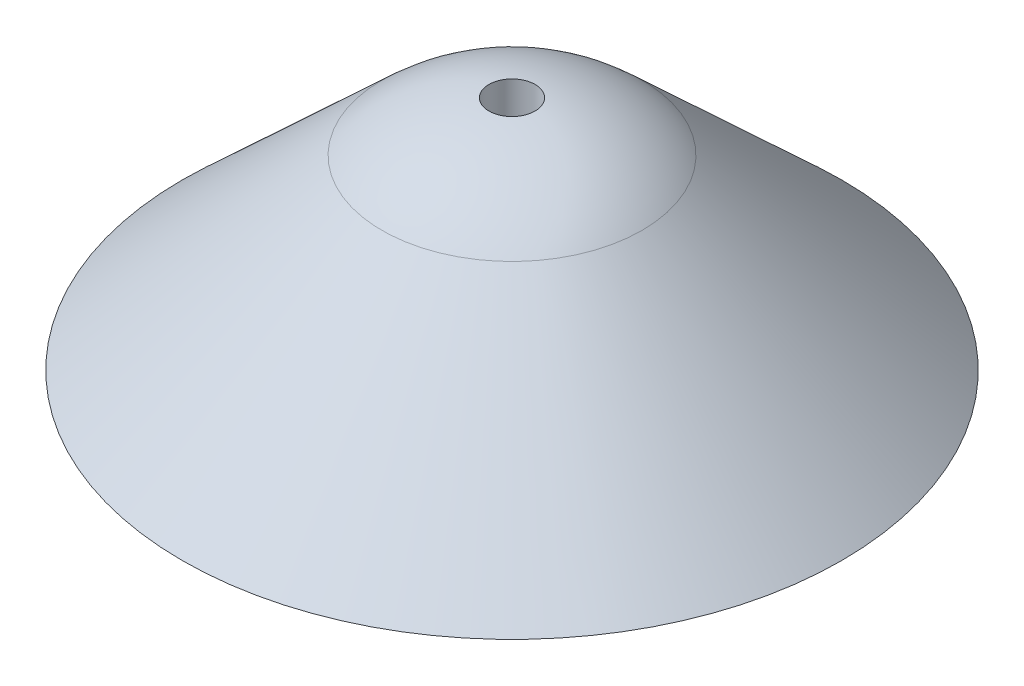
from build123d import *

# Parameters (mm, degrees)
SKETCH2_R          = 1.75
CUT_EXTRUDE1_DEPTH = 40.67366885


with BuildPart() as part:
    # Sketch1 → Revolve1 (revolve)
    with BuildSketch(Plane.XY):
        with BuildLine():
            Line((0, 0), (25, 0))
            Line((25, 0), (9.8641509, 14.114407628))
            ThreePointArc((9.8641509, 14.114407628), (5.300926831, 16.993587596), (0, 18))
            Line((0, 18), (0, 0))
        make_face()
    revolve(axis=Axis((0, 0, 0), (0, 1, 0)))

    # Sketch2 → Cut-Extrude1 (cut, through all)
    with BuildSketch(Plane.XZ):
        Circle(SKETCH2_R)
    extrude(amount=-CUT_EXTRUDE1_DEPTH, mode=Mode.SUBTRACT)


solid = part.part
